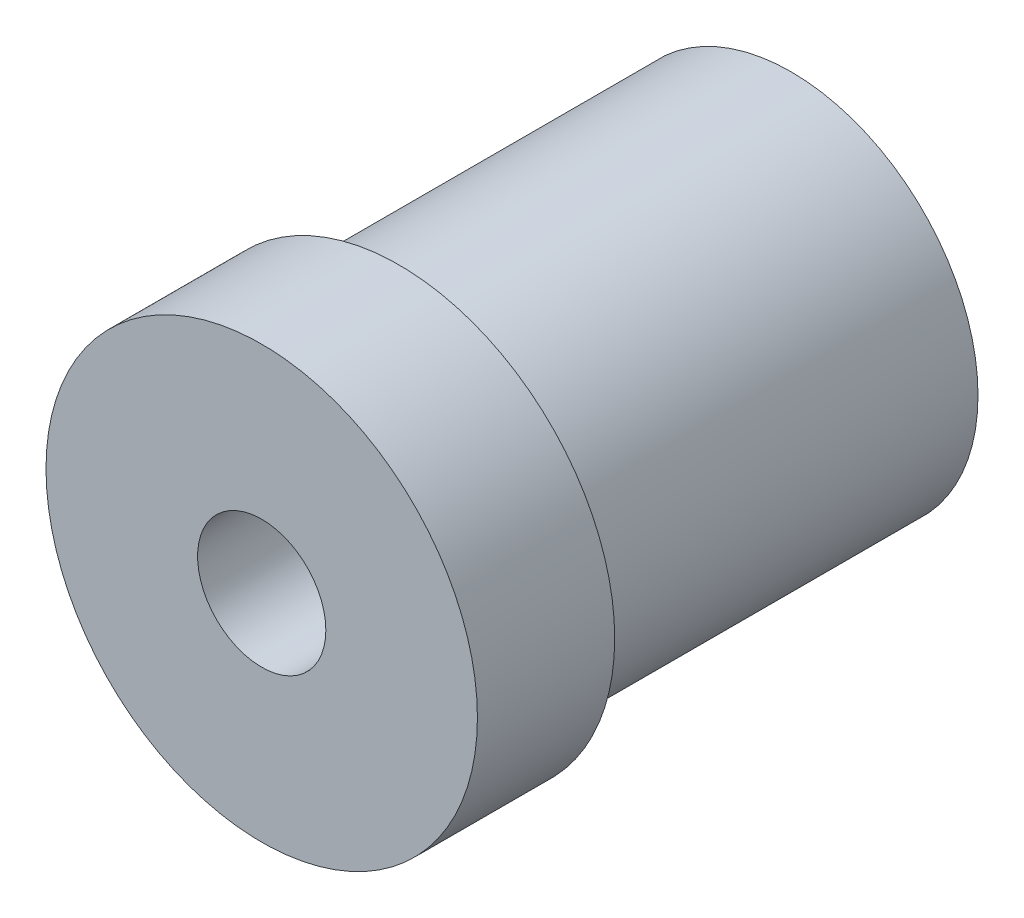
from build123d import *

# Parameters (mm, degrees)
SKETCH1_R           = 9.525
SKETCH1_R_2         = 3.25
BOSS_EXTRUDE1_DEPTH = 20
SKETCH2_R           = 11
BOSS_EXTRUDE2_DEPTH = 7
SKETCH3_R           = 3.27
CUT_EXTRUDE1_DEPTH  = 7


with BuildPart() as part:
    # Sketch1 → Boss-Extrude1 (new body)
    with BuildSketch(Plane.XY):
        Circle(SKETCH1_R)
        Circle(SKETCH1_R_2, mode=Mode.SUBTRACT)
    extrude(amount=BOSS_EXTRUDE1_DEPTH)

    # Sketch2 → Boss-Extrude2 (add)
    with BuildSketch(Plane.XY.offset(20)):
        with Locations(Location((0, 0, 0), (0, 0, 180))):
            Circle(SKETCH2_R)
    extrude(amount=BOSS_EXTRUDE2_DEPTH)

    # Sketch3 → Cut-Extrude1 (cut)
    with BuildSketch(Plane.XY.offset(27)):
        Circle(SKETCH3_R)
    extrude(amount=-CUT_EXTRUDE1_DEPTH, mode=Mode.SUBTRACT)


solid = part.part
